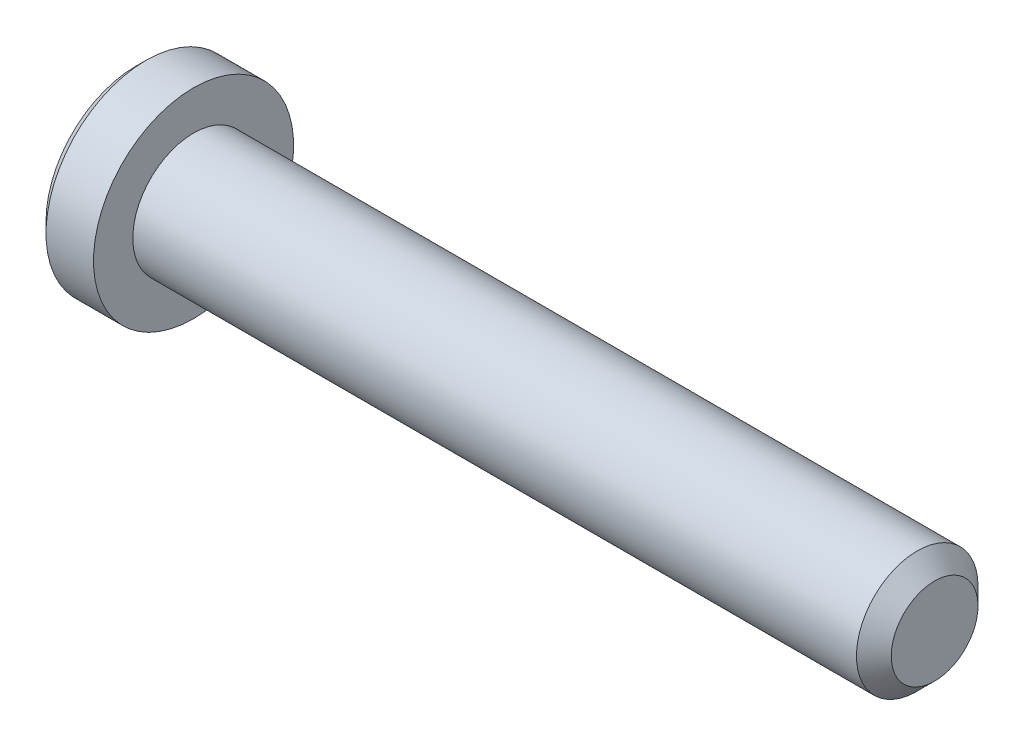
from build123d import *

# Parameters (mm, degrees)
SKETCH2_R           = 2.0828
BOSS_EXTRUDE1_DEPTH = 25.4
CHAMFER1_SIZE       = 0.5953125
CUT_EXTRUDE1_DEPTH  = 1.524


with BuildPart() as part:
    # Sketch2 → Boss-Extrude1 (new body)
    with BuildSketch(Plane(origin=(12.7, 0, 0), x_dir=(0, 0, -1), z_dir=(1, 0, 0))):
        Circle(SKETCH2_R)
    extrude(amount=-BOSS_EXTRUDE1_DEPTH)

    # Chamfer1
    chamfer1_edges = [part.edges().sort_by_distance(p)[0] for p in [
        (12.7, 0, 2.0828),
    ]]
    chamfer(chamfer1_edges, length=CHAMFER1_SIZE)

    # Sketch6 → Revolve1 (revolve)
    with BuildSketch(Plane.XY):
        Polygon((-14.328775, 3.429), (-14.684375, 3.0734), (-14.684375, 0), (-12.7, 0), (-12.7, 3.429), align=None)
    revolve(axis=Axis((-12.7, 0, 0), (-1, 0, 0)))

    # Sketch4 → Cut-Extrude1 (cut)
    with BuildSketch(Plane(origin=(-14.684375, 0, 0), x_dir=(0, 0, -1), z_dir=(1, 0, 0))):
        Polygon((0, 1.14567944), (-0.9921875, 0.57283972), (-0.9921875, -0.57283972), (0, -1.14567944), (0.9921875, -0.57283972), (0.9921875, 0.57283972), align=None)
    extrude(amount=CUT_EXTRUDE1_DEPTH, mode=Mode.SUBTRACT)

    # Cut-Extrude2 cone 1 section (through the dimple's axis) → Cut-Extrude2 (revolve, cut)
    with BuildSketch(Plane(origin=(-14.684375, 0, 0), x_dir=(0, 0, 1), z_dir=(0, 1, 0))):
        Polygon((0, 0), (1.14567944, 0), (0, 1.14567944), align=None)
    revolve(axis=Axis((-14.684375, 0, 0), (1, 0, 0)), mode=Mode.SUBTRACT)


solid = part.part
